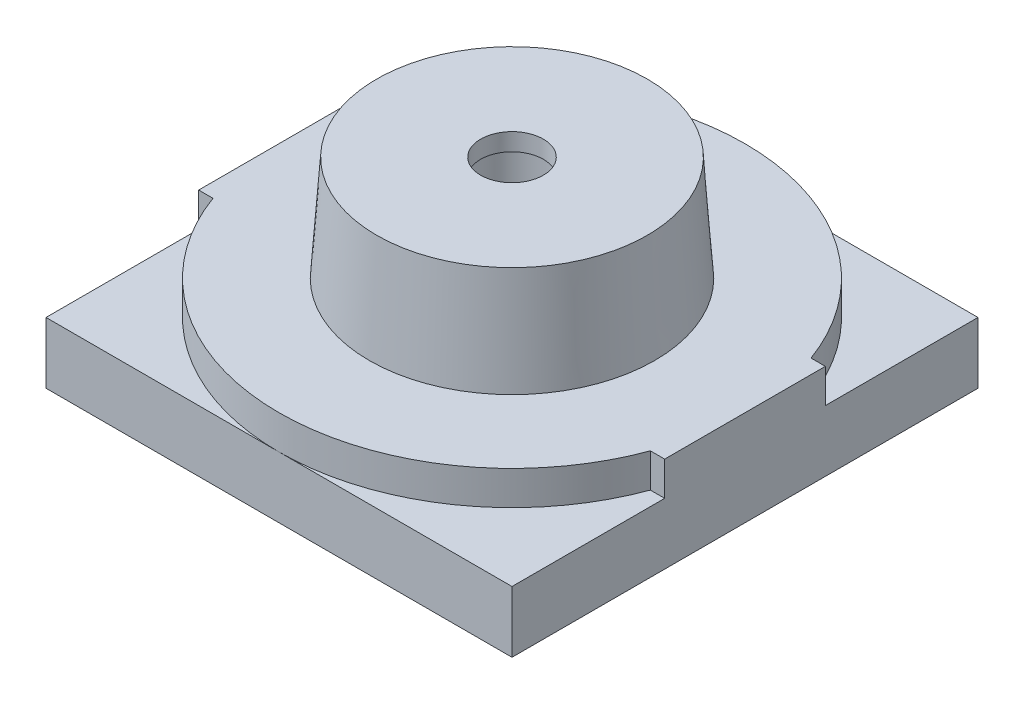
from build123d import *

# Parameters (mm, degrees)
SKETCH1_W               = 7.01
SKETCH1_H               = 7.01
BOSS_EXTRUDE1_DEPTH     = 0.92
SKETCH2_R               = 3.505
BOSS_EXTRUDE2_DEPTH     = 0.83
SKETCH3_R               = 2.135
BOSS_EXTRUDE3_DEPTH     = 1.752116255
SKETCH4_R               = 2.085
CUT_EXTRUDE1_DEPTH      = 1
CUT_EXTRUDE2_DEPTH      = 7.069173606
CUT_EXTRUDE2_DEPTH_BACK = 7.069173606
SKETCH5_W               = 2.65
SKETCH5_H               = 2.65
SKETCH6_W               = 8.843273239
SKETCH6_H               = 10.721573241
SKETCH6_W_2             = 7.01
SKETCH6_H_2             = 7.01
SKETCH6_W_3             = 6
SKETCH6_H_3             = 6
CUT_EXTRUDE3_DEPTH      = 10
SKETCH7_W               = 8.855260717
SKETCH7_H               = 9.729262333
SKETCH7_R               = 3
CUT_EXTRUDE4_DEPTH      = 0.83
SKETCH8_W               = 2.771053774
SKETCH8_H               = 2.773686404
BOSS_EXTRUDE4_DEPTH     = 2.502116255
SKETCH9_R               = 0.554
CUT_EXTRUDE5_DEPTH      = 0.3
SKETCH10_R              = 0.47
CUT_EXTRUDE6_DEPTH      = 100
SKETCH11_R              = 1.501
CUT_EXTRUDE7_DEPTH      = 0.48
SKETCH12_R              = 0.817
CUT_EXTRUDE8_DEPTH      = 0.7
SKETCH14_R              = 0.582
CUT_EXTRUDE9_DEPTH      = 0.56
BOSS_EXTRUDE5_START     = 0.05
SKETCH15_R              = 0.554
SKETCH15_R_2            = 0.47
BOSS_EXTRUDE5_DEPTH     = 0.05
BOSS_EXTRUDE6_START     = 0.79
SKETCH16_R              = 2.085
SKETCH16_R_2            = 1.63
BOSS_EXTRUDE6_DEPTH     = 0.79
BOSS_EXTRUDE7_START     = 0.53
SKETCH17_R              = 1.63
SKETCH17_R_2            = 1.501
BOSS_EXTRUDE7_DEPTH     = 0.53
SKETCH18_R              = 2.572537364
SKETCH18_R_2            = 1.5
CUT_EXTRUDE10_DEPTH     = 1.752116255
BOSS_EXTRUDE8_START     = 0.21
SKETCH19_R              = 2.085
SKETCH19_R_2            = 1.705
BOSS_EXTRUDE8_DEPTH     = 0.21
SKETCH20_W              = 6.707027697
SKETCH20_H              = 11.442069063
SKETCH20_R              = 1.8
CUT_EXTRUDE11_DEPTH     = 0.83
SKETCH21_W              = 6.520255289
SKETCH21_H              = 15.458610975
SKETCH21_W_2            = 3.8
SKETCH21_H_2            = 3.8
CUT_EXTRUDE12_DEPTH     = 10
SKETCH23_W              = 6.99
SKETCH23_H              = 6.99
SKETCH23_W_2            = 3.502421246
SKETCH23_H_2            = 3.548313749
BOSS_EXTRUDE9_DEPTH     = 0.92
SKETCH24_W              = 6.057488838
SKETCH24_H              = 5.341048382
CUT_EXTRUDE14_DEPTH     = 0.13
SKETCH25_R              = 3.495
SKETCH25_R_2            = 1.679124266
BOSS_EXTRUDE10_DEPTH    = 0.83
SKETCH26_W              = 0.8
SKETCH26_H              = 2.36
BOSS_EXTRUDE11_DEPTH    = 0.83
SKETCH27_W              = 0.802423375
SKETCH27_H              = 2.36
BOSS_EXTRUDE12_DEPTH    = 0.83
SKETCH28_R              = 2.14
SKETCH28_R_2            = 1.325961915
BOSS_EXTRUDE13_DEPTH    = 1.622116255
SKETCH29_R              = 2.5
CUT_EXTRUDE15_DEPTH     = 0.21
SKETCH30_W              = 0.025
SKETCH30_H              = 0.83
BOSS_EXTRUDE14_DEPTH    = 0.4
SKETCH31_W              = 0.025
SKETCH31_H              = 0.83
BOSS_EXTRUDE15_DEPTH    = 0.4
SKETCH32_R              = 5.119404283
SKETCH32_R_2            = 2.14
CUT_EXTRUDE16_DEPTH     = 0.32
SKETCH33_W              = 6.584709795
SKETCH33_H              = 4.796866642
CUT_EXTRUDE17_DEPTH     = 0.37
SKETCH35_W              = 5.183427323
SKETCH35_H              = 5.029681598
SKETCH35_R              = 2.14
CUT_EXTRUDE18_DEPTH     = 1.572116
CUT_EXTRUDE18_DRAFT     = -4


with BuildPart() as part:
    # Sketch1 → Boss-Extrude1 (new body)
    with BuildSketch(Plane(origin=(0, 0, 0), x_dir=(1, 0, 0), z_dir=(0, 1, 0))):
        Rectangle(SKETCH1_W, SKETCH1_H)
    extrude(amount=BOSS_EXTRUDE1_DEPTH)

    # Sketch2 → Boss-Extrude2 (add)
    with BuildSketch(Plane(origin=(0, 0.92, 0), x_dir=(1, 0, 0), z_dir=(0, 1, 0))):
        with Locations(Location((0, 0, 0), (0, 0, 270))):
            Circle(SKETCH2_R)
    extrude(amount=BOSS_EXTRUDE2_DEPTH)

    # Sketch3 → Boss-Extrude3 (add)
    with BuildSketch(Plane(origin=(0, 1.75, 0), x_dir=(1, 0, 0), z_dir=(0, 1, 0))):
        with Locations(Location((0, 0, 0), (0, 0, 270))):
            Circle(SKETCH3_R)
    extrude(amount=BOSS_EXTRUDE3_DEPTH)

    # Sketch4 → Cut-Extrude1 (cut)
    with BuildSketch(Plane.XZ):
        with Locations(Location((0, 0, 0), (0, 0, 270))):
            Circle(SKETCH4_R)
    extrude(amount=-CUT_EXTRUDE1_DEPTH, mode=Mode.SUBTRACT)

    # Sketch5 → Cut-Extrude2 (cut, two sides: drawn at the far end of the back side and taken through both)
    with BuildSketch(Plane(origin=(0, 3.502116255, 0), x_dir=(1, 0, 0), z_dir=(0, 1, 0)).offset(-CUT_EXTRUDE2_DEPTH_BACK)):
        Rectangle(SKETCH5_W, SKETCH5_H)
    extrude(amount=CUT_EXTRUDE2_DEPTH + CUT_EXTRUDE2_DEPTH_BACK, mode=Mode.SUBTRACT)

    # Sketch6 → Cut-Extrude3 (cut)
    # profile 1 of 2: a face of its own
    with BuildSketch(Plane.XZ):
        with Locations((-0.050657098, -0.002715124)):
            Rectangle(SKETCH6_W, SKETCH6_H)
        Rectangle(SKETCH6_W_2, SKETCH6_H_2, mode=Mode.SUBTRACT)
    # profile 2 of 2: a face of its own
    with BuildSketch(Plane.XZ):
        Rectangle(SKETCH6_W_2, SKETCH6_H_2)
        Rectangle(SKETCH6_W_3, SKETCH6_H_3, mode=Mode.SUBTRACT)
    extrude(amount=-CUT_EXTRUDE3_DEPTH, mode=Mode.SUBTRACT)

    # Sketch7 → Cut-Extrude4 (cut)
    with BuildSketch(Plane(origin=(0, 1.75, 0), x_dir=(1, 0, 0), z_dir=(0, 1, 0))):
        with Locations((-0.111516438, -0.542198567)):
            Rectangle(SKETCH7_W, SKETCH7_H)
        with Locations(Location((0, 0, 0), (0, 0, 270))):
            Circle(SKETCH7_R, mode=Mode.SUBTRACT)
    extrude(amount=-CUT_EXTRUDE4_DEPTH, mode=Mode.SUBTRACT)

    # Sketch8 → Boss-Extrude4 (add)
    with BuildSketch(Plane.XZ.offset(-1)):
        with Locations((0.002668444, 0.023551669)):
            Rectangle(SKETCH8_W, SKETCH8_H)
    extrude(amount=-BOSS_EXTRUDE4_DEPTH)

    # Sketch9 → Cut-Extrude5 (cut)
    with BuildSketch(Plane(origin=(0, 3.502116255, 0), x_dir=(1, 0, 0), z_dir=(0, 1, 0))):
        with Locations(Location((0, 0, 0), (0, 0, 270))):
            Circle(SKETCH9_R)
    extrude(amount=-CUT_EXTRUDE5_DEPTH, mode=Mode.SUBTRACT)

    # Sketch10 → Cut-Extrude6 (cut)
    with BuildSketch(Plane(origin=(0, 3.202116255, 0), x_dir=(1, 0, 0), z_dir=(0, 1, 0))):
        with Locations(Location((0, 0, 0), (0, 0, 270))):
            Circle(SKETCH10_R)
    extrude(amount=-CUT_EXTRUDE6_DEPTH, mode=Mode.SUBTRACT)

    # Sketch11 → Cut-Extrude7 (cut)
    with BuildSketch(Plane.XZ.offset(-1)):
        with Locations(Location((0, 0, 0), (0, 0, 270))):
            Circle(SKETCH11_R)
    extrude(amount=-CUT_EXTRUDE7_DEPTH, mode=Mode.SUBTRACT)

    # Sketch12 → Cut-Extrude8 (cut)
    with BuildSketch(Plane.XZ.offset(-1.48)):
        with Locations(Location((0, 0, 0), (0, 0, 270))):
            Circle(SKETCH12_R)
    extrude(amount=-CUT_EXTRUDE8_DEPTH, mode=Mode.SUBTRACT)

    # Sketch14 → Cut-Extrude9 (cut)
    with BuildSketch(Plane.XZ.offset(-2.18)):
        with Locations(Location((0, 0, 0), (0, 0, 270))):
            Circle(SKETCH14_R)
    extrude(amount=-CUT_EXTRUDE9_DEPTH, mode=Mode.SUBTRACT)

    # Sketch15 → Boss-Extrude5 (add)
    with BuildSketch(Plane(origin=(0, 3.202116255, 0), x_dir=(1, 0, 0), z_dir=(0, 1, 0)).offset(BOSS_EXTRUDE5_START)):
        with Locations(Location((0, 0, 0), (0, 0, 270))):
            Circle(SKETCH15_R)
        with Locations(Location((0, 0, 0), (0, 0, 270))):
            Circle(SKETCH15_R_2, mode=Mode.SUBTRACT)
    extrude(amount=-BOSS_EXTRUDE5_DEPTH)

    # Sketch16 → Boss-Extrude6 (add)
    with BuildSketch(Plane.XZ.offset(-1).offset(BOSS_EXTRUDE6_START)):
        with Locations(Location((0, 0, 0), (0, 0, 270))):
            Circle(SKETCH16_R)
        with Locations(Location((0, 0, 0), (0, 0, 90))):
            Circle(SKETCH16_R_2, mode=Mode.SUBTRACT)
    extrude(amount=-BOSS_EXTRUDE6_DEPTH)

    # Sketch17 → Boss-Extrude7 (add)
    with BuildSketch(Plane.XZ.offset(-1).offset(BOSS_EXTRUDE7_START)):
        with Locations(Location((0, 0, 0), (0, 0, 90))):
            Circle(SKETCH17_R)
        with Locations(Location((0, 0, 0), (0, 0, 270))):
            Circle(SKETCH17_R_2, mode=Mode.SUBTRACT)
    extrude(amount=-BOSS_EXTRUDE7_DEPTH)

    # Sketch18 → Cut-Extrude10 (cut)
    with BuildSketch(Plane(origin=(0, 3.502116255, 0), x_dir=(1, 0, 0), z_dir=(0, 1, 0))):
        Circle(SKETCH18_R)
        with Locations(Location((0, 0, 0), (0, 0, 270))):
            Circle(SKETCH18_R_2, mode=Mode.SUBTRACT)
    extrude(amount=-CUT_EXTRUDE10_DEPTH, mode=Mode.SUBTRACT)

    # Sketch19 → Boss-Extrude8 (add)
    with BuildSketch(Plane.XZ.offset(-0.21).offset(BOSS_EXTRUDE8_START)):
        Circle(SKETCH19_R)
        with Locations(Location((0, 0, 0), (0, 0, 90))):
            Circle(SKETCH19_R_2, mode=Mode.SUBTRACT)
    extrude(amount=-BOSS_EXTRUDE8_DEPTH)

    # Sketch20 → Cut-Extrude11 (cut)
    with BuildSketch(Plane(origin=(0, 1.75, 0), x_dir=(1, 0, 0), z_dir=(0, 1, 0))):
        with Locations((0.104915626, 1.709559423)):
            Rectangle(SKETCH20_W, SKETCH20_H)
        with Locations(Location((0, 0, 0), (0, 0, 270))):
            Circle(SKETCH20_R, mode=Mode.SUBTRACT)
    extrude(amount=-CUT_EXTRUDE11_DEPTH, mode=Mode.SUBTRACT)

    # Sketch21 → Cut-Extrude12 (cut)
    with BuildSketch(Plane(origin=(0, 0.92, 0), x_dir=(1, 0, 0), z_dir=(0, 1, 0))):
        with Locations((-0.167365124, 0.45607417)):
            Rectangle(SKETCH21_W, SKETCH21_H)
        Rectangle(SKETCH21_W_2, SKETCH21_H_2, mode=Mode.SUBTRACT)
    extrude(amount=-CUT_EXTRUDE12_DEPTH, mode=Mode.SUBTRACT)

    # Sketch23 → Boss-Extrude9 (add)
    with BuildSketch(Plane.XZ):
        Rectangle(SKETCH23_W, SKETCH23_H)
        with Locations((-0.032460289, -0.038632405)):
            Rectangle(SKETCH23_W_2, SKETCH23_H_2, mode=Mode.SUBTRACT)
    extrude(amount=-BOSS_EXTRUDE9_DEPTH)

    # Sketch24 → Cut-Extrude14 (cut)
    with BuildSketch(Plane(origin=(0, 3.502116255, 0), x_dir=(1, 0, 0), z_dir=(0, 1, 0))):
        with Locations((0.48256212, -0.051480008)):
            Rectangle(SKETCH24_W, SKETCH24_H)
    extrude(amount=-CUT_EXTRUDE14_DEPTH, mode=Mode.SUBTRACT)

    # Sketch25 → Boss-Extrude10 (add)
    with BuildSketch(Plane(origin=(0, 0.92, 0), x_dir=(1, 0, 0), z_dir=(0, 1, 0))):
        with Locations(Location((0, 0, 0), (0, 0, 270))):
            Circle(SKETCH25_R)
        Circle(SKETCH25_R_2, mode=Mode.SUBTRACT)
    extrude(amount=BOSS_EXTRUDE10_DEPTH)

    # Sketch26 → Boss-Extrude11 (add)
    with BuildSketch(Plane(origin=(0, 1.75, 0), x_dir=(1, 0, 0), z_dir=(0, 1, 0))):
        with Locations((3.095, 0)):
            Rectangle(SKETCH26_W, SKETCH26_H)
    extrude(amount=-BOSS_EXTRUDE11_DEPTH)

    # Sketch27 → Boss-Extrude12 (add)
    with BuildSketch(Plane(origin=(0, 1.75, 0), x_dir=(1, 0, 0), z_dir=(0, 1, 0))):
        with Locations((-3.093788313, 0)):
            Rectangle(SKETCH27_W, SKETCH27_H)
    extrude(amount=-BOSS_EXTRUDE12_DEPTH)

    # Sketch28 → Boss-Extrude13 (add)
    with BuildSketch(Plane(origin=(0, 3.372116255, 0), x_dir=(1, 0, 0), z_dir=(0, 1, 0))):
        with Locations(Location((0, 0, 0), (0, 0, 270))):
            Circle(SKETCH28_R)
        Circle(SKETCH28_R_2, mode=Mode.SUBTRACT)
    extrude(amount=-BOSS_EXTRUDE13_DEPTH)

    # Sketch29 → Cut-Extrude15 (cut)
    with BuildSketch(Plane.XZ):
        with Locations(Location((0, 0, 0), (0, 0, 270))):
            Circle(SKETCH29_R)
    extrude(amount=-CUT_EXTRUDE15_DEPTH, mode=Mode.SUBTRACT)

    # Sketch30 → Boss-Extrude14 (add)
    with BuildSketch(Plane.ZY.offset(3.495)):
        with Locations((-1.1925, 1.335)):
            Rectangle(SKETCH30_W, SKETCH30_H)
        with Locations((1.1925, 1.335)):
            Rectangle(SKETCH30_W, SKETCH30_H)
    extrude(amount=-BOSS_EXTRUDE14_DEPTH)

    # Sketch31 → Boss-Extrude15 (add)
    with BuildSketch(Plane(origin=(3.495, 0, 0), x_dir=(0, 0, -1), z_dir=(1, 0, 0))):
        with Locations((-1.1925, 1.335)):
            Rectangle(SKETCH31_W, SKETCH31_H)
        with Locations((1.1925, 1.335)):
            Rectangle(SKETCH31_W, SKETCH31_H)
    extrude(amount=-BOSS_EXTRUDE15_DEPTH)

    # Sketch32 → Cut-Extrude16 (cut)
    with BuildSketch(Plane(origin=(0, 1.75, 0), x_dir=(1, 0, 0), z_dir=(0, 1, 0))):
        Circle(SKETCH32_R)
        with Locations(Location((0, 0, 0), (0, 0, 270))):
            Circle(SKETCH32_R_2, mode=Mode.SUBTRACT)
    extrude(amount=-CUT_EXTRUDE16_DEPTH, mode=Mode.SUBTRACT)

    # Sketch33 → Cut-Extrude17 (cut)
    with BuildSketch(Plane(origin=(0, 3.372116255, 0), x_dir=(1, 0, 0), z_dir=(0, 1, 0))):
        with Locations((0.213047648, -0.01757094)):
            Rectangle(SKETCH33_W, SKETCH33_H)
    extrude(amount=-CUT_EXTRUDE17_DEPTH, mode=Mode.SUBTRACT)


with BuildPart() as cut_extrude18_tool:
    # Sketch35 → Cut-Extrude18 (with draft: the straight prism first)
    with BuildSketch(Plane(origin=(0, 1.43, 0), x_dir=(1, 0, 0), z_dir=(0, 1, 0))):
        with Locations((0.01757094, -0.081265598)):
            Rectangle(SKETCH35_W, SKETCH35_H)
        Circle(SKETCH35_R, mode=Mode.SUBTRACT)
    extrude(amount=CUT_EXTRUDE18_DEPTH)
    # Cut-Extrude18: the draft: its side faces are tilted about the plane it starts from
    cut_extrude18_sides = [cut_extrude18_tool.faces().sort_by_distance(p)[0] for p in [
        (-2.574142721, 2.216058, 0.081265598),
        (0.01757094, 2.216058, 2.596106397),
        (2.609284602, 2.216058, 0.081265598),
        (0.01757094, 2.216058, -2.433575201),
        (-2.14, 2.216058, 0),
    ]]
    draft(cut_extrude18_sides, Plane(origin=(0, 1.43, 0), x_dir=(1, 0, 0), z_dir=(0, 1, 0)), CUT_EXTRUDE18_DRAFT)


with BuildPart() as part_1:
    add(part.part)

    # Cut-Extrude18: cut by cut_extrude18_tool
    add(cut_extrude18_tool.part, mode=Mode.SUBTRACT)


solid = part_1.part
